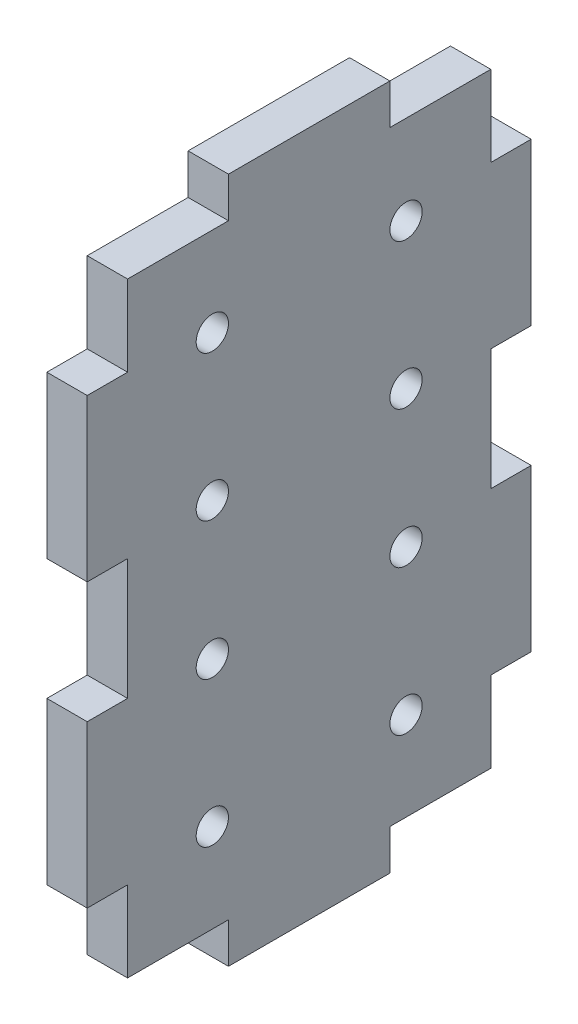
from build123d import *

# Parameters (mm, degrees)
SKETCH_1_R      = 2
EXTRUDE_1_DEPTH = 5


with BuildPart() as part:
    # 草图1 → 凸台-拉伸1 (new body)
    with BuildSketch(Plane(origin=(0, 0, 0), x_dir=(0, 0, -1), z_dir=(1, 0, 0))):
        Polygon((-32.5, 75), (-45, 75), (-45, 65), (-50, 65), (-50, 45), (-45, 45), (-45, 30), (-50, 30), (-50, 10), (-45, 10), (-45, 0), (-32.5, 0), (-32.5, -5), (-12.5, -5), (-12.5, 0), (0, 0), (0, 10), (5, 10), (5, 30), (0, 30), (0, 45), (5, 45), (5, 65), (0, 65), (0, 75), (-12.5, 75), (-12.5, 80), (-32.5, 80), align=None)
        with Locations((-34.5, 64)):
            Circle(SKETCH_1_R, mode=Mode.SUBTRACT)
        with Locations((-10.5, 64)):
            Circle(SKETCH_1_R, mode=Mode.SUBTRACT)
        with Locations((-34.5, 46)):
            Circle(SKETCH_1_R, mode=Mode.SUBTRACT)
        with Locations((-10.5, 46)):
            Circle(SKETCH_1_R, mode=Mode.SUBTRACT)
        with Locations((-34.5, 11)):
            Circle(SKETCH_1_R, mode=Mode.SUBTRACT)
        with Locations((-10.5, 11)):
            Circle(SKETCH_1_R, mode=Mode.SUBTRACT)
        with Locations((-10.5, 29)):
            Circle(SKETCH_1_R, mode=Mode.SUBTRACT)
        with Locations((-34.5, 29)):
            Circle(SKETCH_1_R, mode=Mode.SUBTRACT)
    extrude(amount=EXTRUDE_1_DEPTH)


solid = part.part
